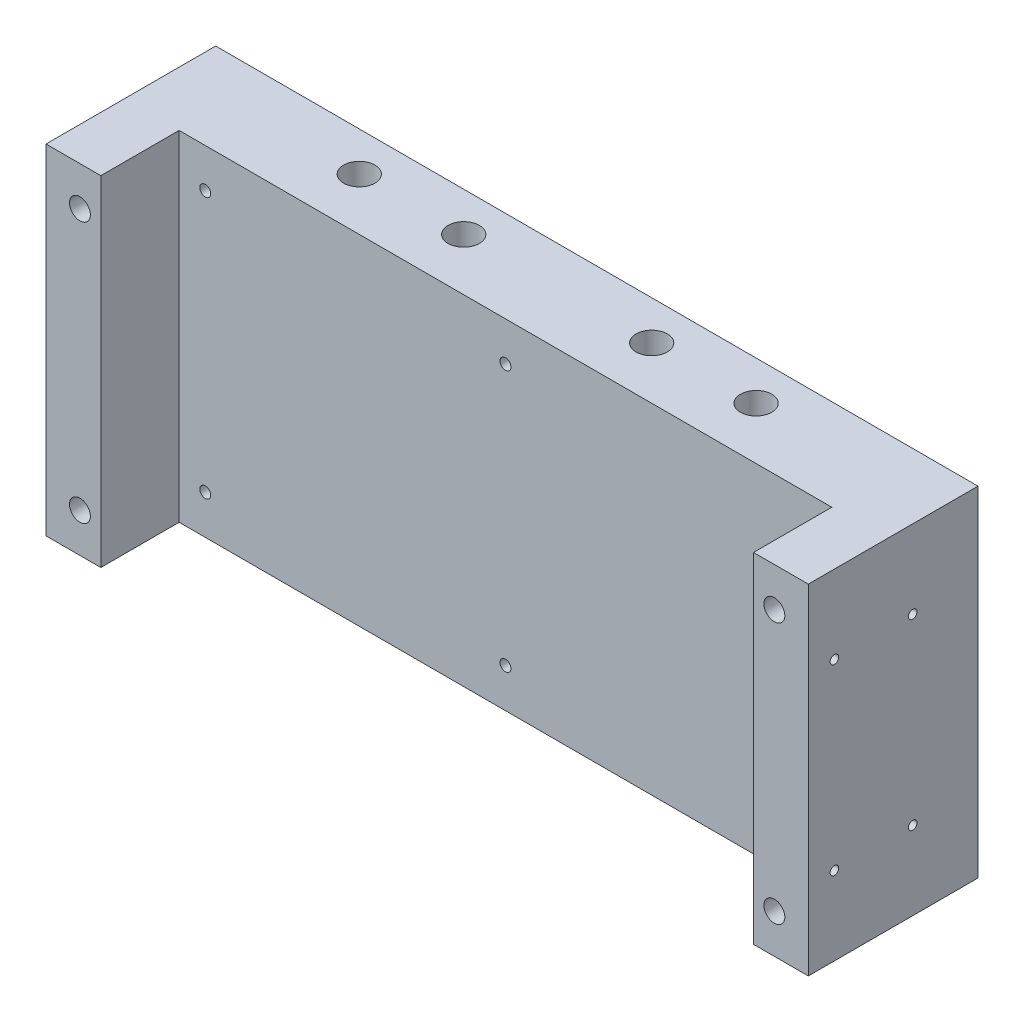
from build123d import *

# Parameters (mm, degrees)
SKETCH1_W                   = 292
SKETCH1_H                   = 35
BOSS_EXTRUDE1_DEPTH         = 130
SKETCH4_W                   = 21
SKETCH4_H                   = 130
BOSS_EXTRUDE2_DEPTH         = 30
SKETCH2_R                   = 4
CUT_EXTRUDE1_DEPTH          = 291.044824122
M5_TAPPED_HOLE1_D           = 4.2
TAP_DRILL_FOR_M4_TAP1_D     = 3.3
TAP_DRILL_FOR_M4_TAP1_DEPTH = 6
TAP_DRILL_FOR_M4_TAP1_TIP   = 0.991420021
TAP_DRILL_FOR_M4_TAP2_D     = 3.3
TAP_DRILL_FOR_M4_TAP2_DEPTH = 6
TAP_DRILL_FOR_M4_TAP2_TIP   = 0.991420021
CUT_EXTRUDE2_DEPTH          = 30
F_12_0MM_DOWEL_HOLE1_D      = 12
F_12_0MM_DOWEL_HOLE1_DEPTH  = 10
F_12_0MM_DOWEL_HOLE1_TIP    = 3.605163714
F_8_0MM_DOWEL_HOLE1_D       = 8
F_8_0MM_DOWEL_HOLE1_DEPTH   = 10
F_8_0MM_DOWEL_HOLE1_TIP     = 2.403442476


with BuildPart() as part:
    # Sketch1 → Boss-Extrude1 (new body)
    with BuildSketch(Plane(origin=(0, 0, 0), x_dir=(1, 0, 0), z_dir=(0, 1, 0))):
        with Locations((105, 47.5)):
            Rectangle(SKETCH1_W, SKETCH1_H)
    extrude(amount=BOSS_EXTRUDE1_DEPTH)

    # Sketch4 → Boss-Extrude2 (add)
    with BuildSketch(Plane.XY.offset(-30)):
        with Locations((-30.5, 65)):
            Rectangle(SKETCH4_W, SKETCH4_H)
        with Locations((240.5, 65)):
            Rectangle(SKETCH4_W, SKETCH4_H)
    extrude(amount=BOSS_EXTRUDE2_DEPTH)

    # Sketch2 → Cut-Extrude1 (cut, through all)
    with BuildSketch(Plane.XY.offset(-65)):
        with Locations(Location((238, 115, 0), (0, 0, 180))):
            Circle(SKETCH2_R)
        with Locations(Location((-28, 115, 0), (0, 0, 180))):
            Circle(SKETCH2_R)
        with Locations(Location((-28, 15, 0), (0, 0, 180))):
            Circle(SKETCH2_R)
        with Locations(Location((238, 15, 0), (0, 0, 180))):
            Circle(SKETCH2_R)
    extrude(amount=CUT_EXTRUDE1_DEPTH, mode=Mode.SUBTRACT)

    # M5 Tapped Hole1 (through all)
    with Locations(Plane.XY.offset(-30)):
        with Locations((-10, 115), (105, 115), (220, 115), (220, 15), (105, 15), (-10, 15)):
            Hole(M5_TAPPED_HOLE1_D / 2)

    # Tap Drill for M4 Tap1
    with Locations(Plane.ZY.offset(41)):
        with Locations((-55, 100), (-25, 100), (-55, 30), (-25, 30)):
            Hole(TAP_DRILL_FOR_M4_TAP1_D / 2, depth=TAP_DRILL_FOR_M4_TAP1_DEPTH)
            with Locations((0, 0, -(TAP_DRILL_FOR_M4_TAP1_DEPTH + TAP_DRILL_FOR_M4_TAP1_TIP / 2))):  # 118° drill point
                Cone(0, TAP_DRILL_FOR_M4_TAP1_D / 2, TAP_DRILL_FOR_M4_TAP1_TIP, mode=Mode.SUBTRACT)

    # Tap Drill for M4 Tap2
    with Locations(Plane(origin=(251, 0, 0), x_dir=(0, 0, -1), z_dir=(1, 0, 0))):
        with Locations((10, 100), (40, 100), (10, 30), (40, 30)):
            Hole(TAP_DRILL_FOR_M4_TAP2_D / 2, depth=TAP_DRILL_FOR_M4_TAP2_DEPTH)
            with Locations((0, 0, -(TAP_DRILL_FOR_M4_TAP2_DEPTH + TAP_DRILL_FOR_M4_TAP2_TIP / 2))):  # 118° drill point
                Cone(0, TAP_DRILL_FOR_M4_TAP2_D / 2, TAP_DRILL_FOR_M4_TAP2_TIP, mode=Mode.SUBTRACT)

    # Sketch31 → Cut-Extrude2 (cut)
    with BuildSketch(Plane(origin=(0, 0, -65), x_dir=(-1, 0, 0), z_dir=(0, 0, -1))):
        with BuildLine():
            Line((-191, 120), (-131, 120))
            ThreePointArc((-131, 120), (-123.928932188, 117.071067812), (-121, 110))
            Line((-121, 110), (-121, 20))
            ThreePointArc((-121, 20), (-123.928932188, 12.928932188), (-131, 10))
            Line((-131, 10), (-191, 10))
            ThreePointArc((-191, 10), (-198.071067812, 12.928932188), (-201, 20))
            Line((-201, 20), (-201, 110))
            ThreePointArc((-201, 110), (-198.071067812, 117.071067812), (-191, 120))
        make_face()
        with BuildLine():
            Line((-79, 120), (-19, 120))
            ThreePointArc((-19, 120), (-11.928932188, 117.071067812), (-9, 110))
            Line((-9, 110), (-9, 20))
            ThreePointArc((-9, 20), (-11.928932188, 12.928932188), (-19, 10))
            Line((-19, 10), (-79, 10))
            ThreePointArc((-79, 10), (-86.071067812, 12.928932188), (-89, 20))
            Line((-89, 20), (-89, 110))
            ThreePointArc((-89, 110), (-86.071067812, 117.071067812), (-79, 120))
        make_face()
    extrude(amount=-CUT_EXTRUDE2_DEPTH, mode=Mode.SUBTRACT)

    # Ø12.0mm Dowel Hole1
    with Locations(Plane(origin=(0, 130, 0), x_dir=(1, 0, 0), z_dir=(0, 1, 0))):
        with Locations((29, 50), (69, 50), (141, 50), (181, 50)):
            Hole(F_12_0MM_DOWEL_HOLE1_D / 2, depth=F_12_0MM_DOWEL_HOLE1_DEPTH)
            with Locations((0, 0, -(F_12_0MM_DOWEL_HOLE1_DEPTH + F_12_0MM_DOWEL_HOLE1_TIP / 2))):  # 118° drill point
                Cone(0, F_12_0MM_DOWEL_HOLE1_D / 2, F_12_0MM_DOWEL_HOLE1_TIP, mode=Mode.SUBTRACT)

    # Ø8.0mm Dowel Hole1
    with Locations(Plane(origin=(0, 10, 0), x_dir=(1, 0, 0), z_dir=(0, 1, 0))):
        with Locations((69, 50), (29, 50), (141, 50), (181, 50)):
            Hole(F_8_0MM_DOWEL_HOLE1_D / 2, depth=F_8_0MM_DOWEL_HOLE1_DEPTH)
            with Locations((0, 0, -(F_8_0MM_DOWEL_HOLE1_DEPTH + F_8_0MM_DOWEL_HOLE1_TIP / 2))):  # 118° drill point
                Cone(0, F_8_0MM_DOWEL_HOLE1_D / 2, F_8_0MM_DOWEL_HOLE1_TIP, mode=Mode.SUBTRACT)


solid = part.part
